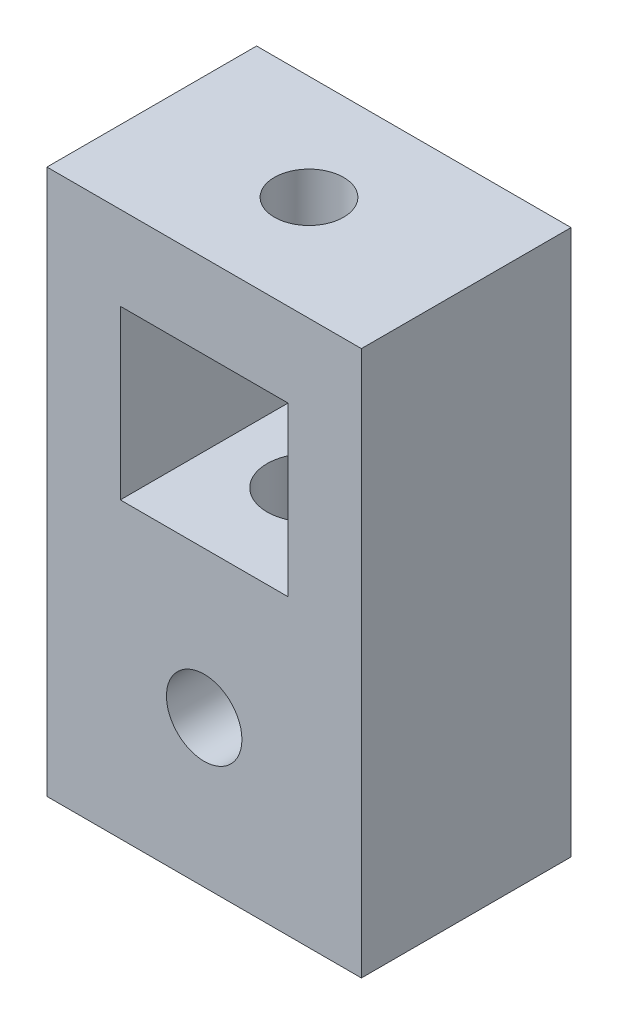
from build123d import *

# Parameters (mm, degrees)
SKETCH1_W           = 15
SKETCH1_H           = 14
BOSS_EXTRUDE1_DEPTH = 10
SKETCH2_R           = 1.8
CUT_EXTRUDE1_DEPTH  = 17.26246018
SKETCH3_R           = 2
CUT_EXTRUDE2_DEPTH  = 5
SKETCH4_W           = 3.5
SKETCH4_H           = 10
BOSS_EXTRUDE2_DEPTH = 8
SKETCH5_W           = 15
SKETCH5_H           = 10
BOSS_EXTRUDE3_DEPTH = 4
SKETCH6_R           = 1.65
CUT_EXTRUDE3_DEPTH  = 4


with BuildPart() as part:
    # Sketch1 → Boss-Extrude1 (new body)
    with BuildSketch(Plane.XY):
        with Locations((-0.595285601, 2.94655529)):
            Rectangle(SKETCH1_W, SKETCH1_H)
    extrude(amount=BOSS_EXTRUDE1_DEPTH)

    # Sketch2 → Cut-Extrude1 (cut, through all)
    with BuildSketch(Plane.XY.offset(10)):
        with Locations((-0.595285601, 2.94655529)):
            Circle(SKETCH2_R)
    extrude(amount=-CUT_EXTRUDE1_DEPTH, mode=Mode.SUBTRACT)

    # Sketch3 → Cut-Extrude2 (cut)
    with BuildSketch(Plane(origin=(0, 9.94655529, 0), x_dir=(1, 0, 0), z_dir=(0, 1, 0))):
        with Locations(Location((-0.595285601, -5, 0), (0, 0, 270))):
            Circle(SKETCH3_R)
    extrude(amount=-CUT_EXTRUDE2_DEPTH, mode=Mode.SUBTRACT)

    # Sketch4 → Boss-Extrude2 (add)
    with BuildSketch(Plane(origin=(0, 9.94655529, 0), x_dir=(1, 0, 0), z_dir=(0, 1, 0))):
        with Locations((-6.345285601, -5)):
            Rectangle(SKETCH4_W, SKETCH4_H)
        with Locations((5.154714399, -5)):
            Rectangle(SKETCH4_W, SKETCH4_H)
    extrude(amount=BOSS_EXTRUDE2_DEPTH)

    # Sketch5 → Boss-Extrude3 (add)
    with BuildSketch(Plane(origin=(0, 17.94655529, 0), x_dir=(1, 0, 0), z_dir=(0, 1, 0))):
        with Locations((-0.595285601, -5)):
            Rectangle(SKETCH5_W, SKETCH5_H)
    extrude(amount=BOSS_EXTRUDE3_DEPTH)

    # Sketch6 → Cut-Extrude3 (cut)
    with BuildSketch(Plane(origin=(0, 21.94655529, 0), x_dir=(1, 0, 0), z_dir=(0, 1, 0))):
        with Locations(Location((-0.595285601, -5, 0), (0, 0, 270))):
            Circle(SKETCH6_R)
    extrude(amount=-CUT_EXTRUDE3_DEPTH, mode=Mode.SUBTRACT)


solid = part.part
